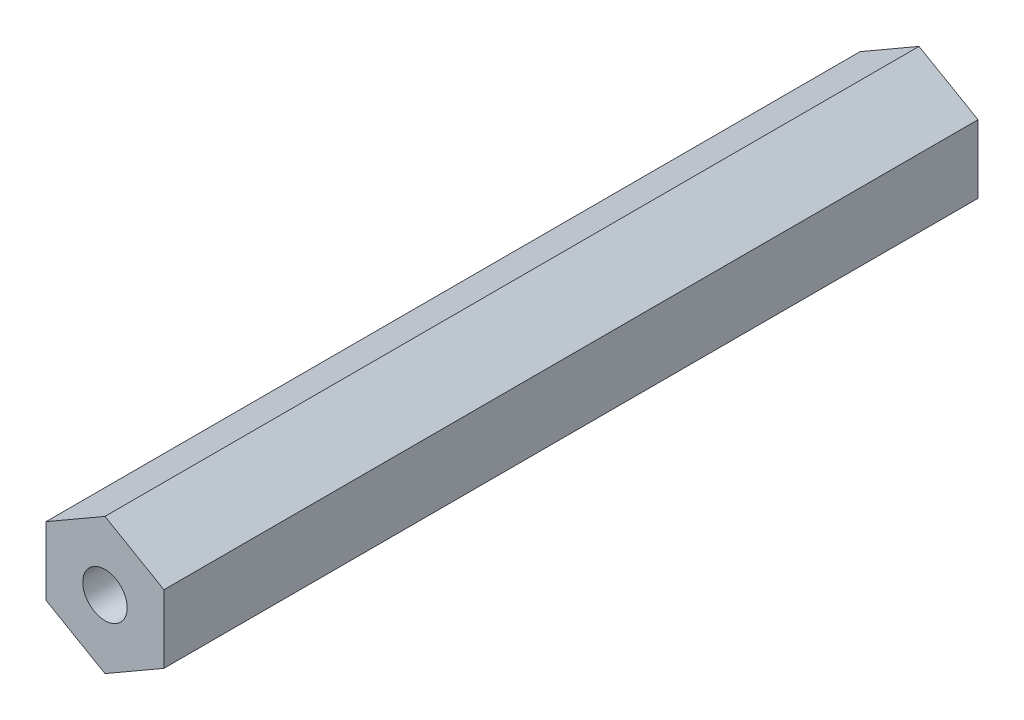
from build123d import *

# Parameters (mm, degrees)
SKETCH_1_R      = 1.5
EXTRUDE_1_DEPTH = 55


with BuildPart() as part:
    # 草图1 → 凸台-拉伸1 (new body)
    with BuildSketch(Plane.XY):
        Polygon((3.983716857, -2.3), (3.983716857, 2.3), (0, 4.6), (-3.983716857, 2.3), (-3.983716857, -2.3), (0, -4.6), align=None)
        Circle(SKETCH_1_R, mode=Mode.SUBTRACT)
    extrude(amount=EXTRUDE_1_DEPTH)


solid = part.part
